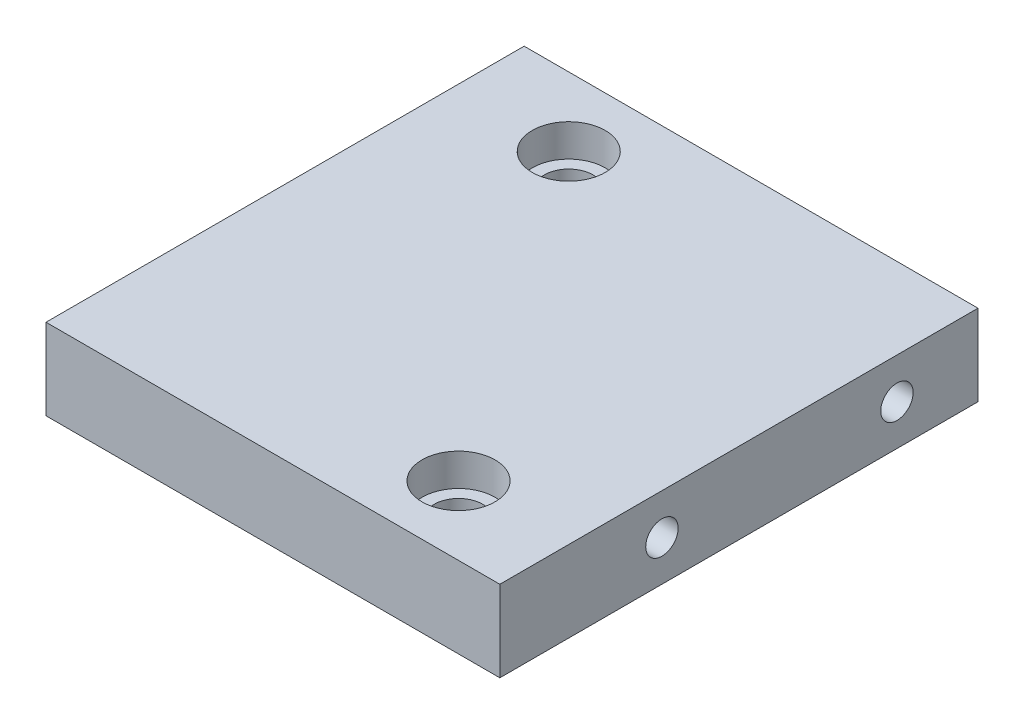
from build123d import *

# Parameters (mm, degrees)
SKETCH_1_W          = 28
SKETCH_1_H          = 29.5
EXTRUDE_1_DEPTH     = 5
SKETCH_1_20_R       = 1.5
CUT_EXTRUDE_1_DEPTH = 41.978652979
CUT_EXTRUDE_START   = 5
SKETCH_1_21_R       = 2.25
CUT_EXTRUDE_2_DEPTH = 2
CUT_EXTRUDE_START_2 = -28
SKETCH_4_R          = 1
CUT_EXTRUDE_3_DEPTH = 4


with BuildPart() as part:
    # 草图1 → 凸台-拉伸1 (new body)
    with BuildSketch(Plane(origin=(0, 0, 0), x_dir=(1, 0, 0), z_dir=(0, 1, 0))):
        with Locations((-14, -14.75)):
            Rectangle(SKETCH_1_W, SKETCH_1_H)
    extrude(amount=EXTRUDE_1_DEPTH)

    # 草图1<20> → 切除-拉伸1 (cut, through all)
    with BuildSketch(Plane(origin=(0, 0, 0), x_dir=(1, 0, 0), z_dir=(0, 1, 0))):
        with Locations(Location((-21, -4.25, 0), (0, 0, 270))):
            Circle(SKETCH_1_20_R)
        with Locations(Location((-6.8, -25.25, 0), (0, 0, 270))):
            Circle(SKETCH_1_20_R)
    extrude(amount=CUT_EXTRUDE_1_DEPTH, mode=Mode.SUBTRACT)

    # 草图1<21> → 切除-拉伸2 (cut)
    with BuildSketch(Plane(origin=(0, 0, 0), x_dir=(1, 0, 0), z_dir=(0, 1, 0)).offset(CUT_EXTRUDE_START)):
        with Locations(Location((-21, -4.25, 0), (0, 0, 270))):
            Circle(SKETCH_1_21_R)
        with Locations(Location((-6.8, -25.25, 0), (0, 0, 270))):
            Circle(SKETCH_1_21_R)
    extrude(amount=-CUT_EXTRUDE_2_DEPTH, mode=Mode.SUBTRACT)

    # 草图4 → 切除-拉伸3 (cut)
    with BuildSketch(Plane.ZY.offset(28).offset(CUT_EXTRUDE_START_2)):
        with Locations((5, 2.5)):
            Circle(SKETCH_4_R)
        with Locations((19.5, 2.5)):
            Circle(SKETCH_4_R)
    extrude(amount=CUT_EXTRUDE_3_DEPTH, mode=Mode.SUBTRACT)


solid = part.part
